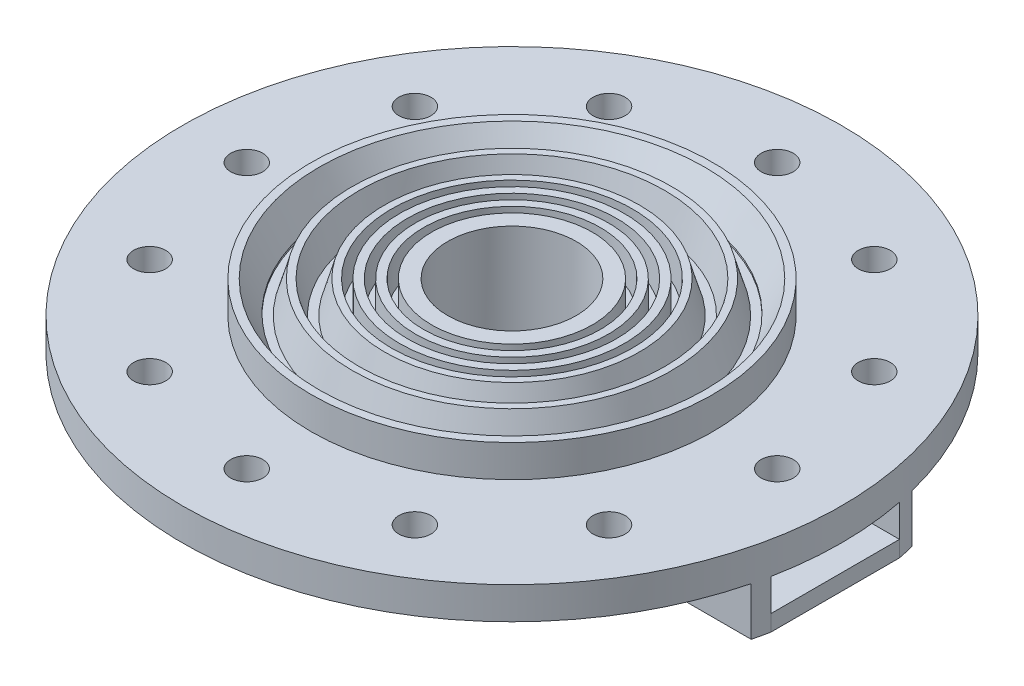
from build123d import *
from build123d.topology import SkipClean

# Parameters (mm, degrees)
SKETCH1_R             = 15.875
SKETCH1_R_2           = 12.7
BOSS_EXTRUDE2_DEPTH   = 12.7
SKETCH1_R_3           = 26.9875
SKETCH1_R_4           = 23.8125
BOSS_EXTRUDE2_2_DEPTH = 12.7
SKETCH1_R_5           = 33.3375
SKETCH1_R_6           = 28.575
BOSS_EXTRUDE2_3_DEPTH = 12.7
SKETCH1_R_7           = 39.6875
SKETCH1_R_8           = 34.925
BOSS_EXTRUDE2_4_DEPTH = 12.7
CHAMFER1_SIZE         = 3.175
CHAMFER1_SIZE2        = 5.971306527
CHAMFER2_SIZE         = 6.35
CHAMFER2_SIZE2        = 1.8208332
CHAMFER3_SIZE         = 1.5875
CHAMFER3_SIZE2        = 6.367114732
CHAMFER4_SIZE         = 6.35
CHAMFER4_SIZE2        = 1.8208332
SKETCH1_20_R          = 65.0875
SKETCH1_20_R_2        = 39.6875
SKETCH1_20_R_3        = 3.175
SKETCH1_20_R_4        = 34.925
SKETCH1_20_R_5        = 33.3375
SKETCH1_20_R_6        = 28.575
SKETCH1_20_R_7        = 26.9875
SKETCH1_20_R_8        = 23.8125
SKETCH1_20_R_9        = 22.225
SKETCH1_20_R_10       = 20.6375
SKETCH1_20_R_11       = 19.05
SKETCH1_20_R_12       = 17.4625
SKETCH1_20_R_13       = 15.875
BOSS_EXTRUDE3_DEPTH   = 6.35
SKETCH1_21_R          = 22.225
SKETCH1_21_R_2        = 20.6375
SKETCH1_21_R_3        = 19.05
SKETCH1_21_R_4        = 17.4625
BOSS_EXTRUDE4_DEPTH   = 12.7
BOSS_EXTRUDE6_START   = -6.35
BOSS_EXTRUDE6_DEPTH   = 6.35
BOSS_EXTRUDE7_START   = 3.175
BOSS_EXTRUDE7_DEPTH   = 3.175


with BuildPart() as part:
    # Sketch1 → Boss-Extrude2 (new body)
    with BuildSketch(Plane(origin=(0, 0, 0), x_dir=(1, 0, 0), z_dir=(0, 1, 0))):
        Circle(SKETCH1_R)
        Circle(SKETCH1_R_2, mode=Mode.SUBTRACT)
    extrude(amount=BOSS_EXTRUDE2_DEPTH)



with BuildPart() as body_2:
    # Sketch1 → Boss-Extrude2 2 (new body)
    with BuildSketch(Plane(origin=(0, 0, 0), x_dir=(1, 0, 0), z_dir=(0, 1, 0))):
        Circle(SKETCH1_R_3)
        Circle(SKETCH1_R_4, mode=Mode.SUBTRACT)
    extrude(amount=BOSS_EXTRUDE2_2_DEPTH)

    # Chamfer4
    chamfer4_edges = [body_2.edges().sort_by_distance(p)[0] for p in [
        (-26.9875, 12.7, 0),
    ]]
    chamfer4_side = [body_2.faces().sort_by_distance(p)[0] for p in [
        (-26.9875, 6.35, 0),
    ]]
    chamfer(chamfer4_edges, length=CHAMFER4_SIZE, length2=CHAMFER4_SIZE2, reference=chamfer4_side[0])


with BuildPart() as body_3:
    # Sketch1 → Boss-Extrude2 3 (new body)
    with BuildSketch(Plane(origin=(0, 0, 0), x_dir=(1, 0, 0), z_dir=(0, 1, 0))):
        Circle(SKETCH1_R_5)
        Circle(SKETCH1_R_6, mode=Mode.SUBTRACT)
    extrude(amount=BOSS_EXTRUDE2_3_DEPTH)

    # Chamfer2
    chamfer2_edges = [body_3.edges().sort_by_distance(p)[0] for p in [
        (-33.3375, 12.7, 0),
    ]]
    chamfer2_side = [body_3.faces().sort_by_distance(p)[0] for p in [
        (-33.3375, 6.35, 0),
    ]]
    chamfer(chamfer2_edges, length=CHAMFER2_SIZE, length2=CHAMFER2_SIZE2, reference=chamfer2_side[0])

    # Chamfer3
    chamfer3_edges = [body_3.edges().sort_by_distance(p)[0] for p in [
        (-28.575, 12.7, 0),
    ]]
    chamfer3_side = [body_3.faces().sort_by_distance(p)[0] for p in [
        (-30.625240848, 12.7, 0),
    ]]
    chamfer(chamfer3_edges, length=CHAMFER3_SIZE, length2=CHAMFER3_SIZE2, reference=chamfer3_side[0])


with BuildPart() as body_4:
    # Sketch1 → Boss-Extrude2 4 (new body)
    with BuildSketch(Plane(origin=(0, 0, 0), x_dir=(1, 0, 0), z_dir=(0, 1, 0))):
        Circle(SKETCH1_R_7)
        Circle(SKETCH1_R_8, mode=Mode.SUBTRACT)
    extrude(amount=BOSS_EXTRUDE2_4_DEPTH)

    # Chamfer1
    chamfer1_edges = [body_4.edges().sort_by_distance(p)[0] for p in [
        (-34.925, 12.7, 0),
    ]]
    chamfer1_side = [body_4.faces().sort_by_distance(p)[0] for p in [
        (-38.564967985, 12.7, 0),
    ]]
    chamfer(chamfer1_edges, length=CHAMFER1_SIZE, length2=CHAMFER1_SIZE2, reference=chamfer1_side[0])


with BuildPart() as part_1:
    add(part.part)

    add(body_2.part)  # Boss-Extrude3 merges body 2

    add(body_3.part)  # Boss-Extrude3 merges body 3

    add(body_4.part)  # Boss-Extrude3 merges body 4
    # Sketch1<20> → Boss-Extrude3 (add)
    # profile 1 of 6: a face of its own
    with BuildSketch(Plane(origin=(0, 0, 0), x_dir=(1, 0, 0), z_dir=(0, 1, 0))):
        Circle(SKETCH1_20_R)
        Circle(SKETCH1_20_R_2, mode=Mode.SUBTRACT)
        with Locations((-26.19375, -45.368905841)):
            Circle(SKETCH1_20_R_3, mode=Mode.SUBTRACT)
        with Locations((-45.368905841, -26.19375)):
            Circle(SKETCH1_20_R_3, mode=Mode.SUBTRACT)
        with Locations((-52.3875, 0)):
            Circle(SKETCH1_20_R_3, mode=Mode.SUBTRACT)
        with Locations((0, -52.3875)):
            Circle(SKETCH1_20_R_3, mode=Mode.SUBTRACT)
        with Locations((26.19375, -45.368905841)):
            Circle(SKETCH1_20_R_3, mode=Mode.SUBTRACT)
        with Locations((45.368905841, -26.19375)):
            Circle(SKETCH1_20_R_3, mode=Mode.SUBTRACT)
        with Locations((-45.368905841, 26.19375)):
            Circle(SKETCH1_20_R_3, mode=Mode.SUBTRACT)
        with Locations((-26.19375, 45.368905841)):
            Circle(SKETCH1_20_R_3, mode=Mode.SUBTRACT)
        with Locations((0, 52.3875)):
            Circle(SKETCH1_20_R_3, mode=Mode.SUBTRACT)
        with Locations((45.368905841, 26.19375)):
            Circle(SKETCH1_20_R_3, mode=Mode.SUBTRACT)
        with Locations((26.19375, 45.368905841)):
            Circle(SKETCH1_20_R_3, mode=Mode.SUBTRACT)
        with Locations((52.3875, 0)):
            Circle(SKETCH1_20_R_3, mode=Mode.SUBTRACT)
    # profile 2 of 6: a face of its own
    with BuildSketch(Plane(origin=(0, 0, 0), x_dir=(1, 0, 0), z_dir=(0, 1, 0))):
        Circle(SKETCH1_20_R_4)
        Circle(SKETCH1_20_R_5, mode=Mode.SUBTRACT)
    # profile 3 of 6: a face of its own
    with BuildSketch(Plane(origin=(0, 0, 0), x_dir=(1, 0, 0), z_dir=(0, 1, 0))):
        Circle(SKETCH1_20_R_6)
        Circle(SKETCH1_20_R_7, mode=Mode.SUBTRACT)
    # profile 4 of 6: a face of its own
    with BuildSketch(Plane(origin=(0, 0, 0), x_dir=(1, 0, 0), z_dir=(0, 1, 0))):
        Circle(SKETCH1_20_R_8)
        Circle(SKETCH1_20_R_9, mode=Mode.SUBTRACT)
    # profile 5 of 6: a face of its own
    with BuildSketch(Plane(origin=(0, 0, 0), x_dir=(1, 0, 0), z_dir=(0, 1, 0))):
        Circle(SKETCH1_20_R_10)
        Circle(SKETCH1_20_R_11, mode=Mode.SUBTRACT)
    # profile 6 of 6: a face of its own
    with BuildSketch(Plane(origin=(0, 0, 0), x_dir=(1, 0, 0), z_dir=(0, 1, 0))):
        Circle(SKETCH1_20_R_12)
        Circle(SKETCH1_20_R_13, mode=Mode.SUBTRACT)
    extrude(amount=BOSS_EXTRUDE3_DEPTH)

    # Sketch1<21> → Boss-Extrude4 (add)
    # profile 1 of 2: a face of its own
    with BuildSketch(Plane(origin=(0, 0, 0), x_dir=(1, 0, 0), z_dir=(0, 1, 0))):
        Circle(SKETCH1_21_R)
        Circle(SKETCH1_21_R_2, mode=Mode.SUBTRACT)
    # profile 2 of 2: a face of its own
    with BuildSketch(Plane(origin=(0, 0, 0), x_dir=(1, 0, 0), z_dir=(0, 1, 0))):
        Circle(SKETCH1_21_R_3)
        Circle(SKETCH1_21_R_4, mode=Mode.SUBTRACT)
    extrude(amount=BOSS_EXTRUDE4_DEPTH)

    # Sketch1<24> → Boss-Extrude6 (add)
    with BuildSketch(Plane(origin=(0, 0, 0), x_dir=(1, 0, 0), z_dir=(0, 1, 0)).offset(BOSS_EXTRUDE6_START)):
        with BuildLine():
            Line((0, 12.7), (63.83645241, 12.7))
            ThreePointArc((63.83645241, 12.7), (63.498994742, 14.291967079), (63.121842743, 15.875))
            Line((63.121842743, 15.875), (0, 15.875))
            ThreePointArc((0, 15.875), (-15.875, 0), (0, -15.875))
            Line((0, -15.875), (63.121842743, -15.875))
            ThreePointArc((63.121842743, -15.875), (63.498994742, -14.291967079), (63.83645241, -12.7))
            Line((63.83645241, -12.7), (0, -12.7))
            ThreePointArc((0, -12.7), (-12.7, 0), (0, 12.7))
        make_face()
    extrude(amount=BOSS_EXTRUDE6_DEPTH)

    # Sketch2 → Boss-Extrude7 (add)
    with SkipClean():  # the faces are left unmerged after this step: merging them gives an invalid solid
        with BuildSketch(Plane(origin=(0, -6.35, 0), x_dir=(-1, 0, 0), z_dir=(0, -1, 0)).offset(BOSS_EXTRUDE7_START)):
            with BuildLine():
                ThreePointArc((0, -15.875), (15.875, 0), (0, 15.875))
                Line((0, 15.875), (-63.121842743, 15.875))
                ThreePointArc((-63.121842743, 15.875), (-63.498994742, 14.291967079), (-63.83645241, 12.7))
                Line((-63.83645241, 12.7), (-63.83645241, -12.7))
                ThreePointArc((-63.83645241, -12.7), (-63.498994742, -14.291967079), (-63.121842743, -15.875))
                Line((-63.121842743, -15.875), (0, -15.875))
            make_face()
        extrude(amount=-BOSS_EXTRUDE7_DEPTH)


solid = part_1.part
